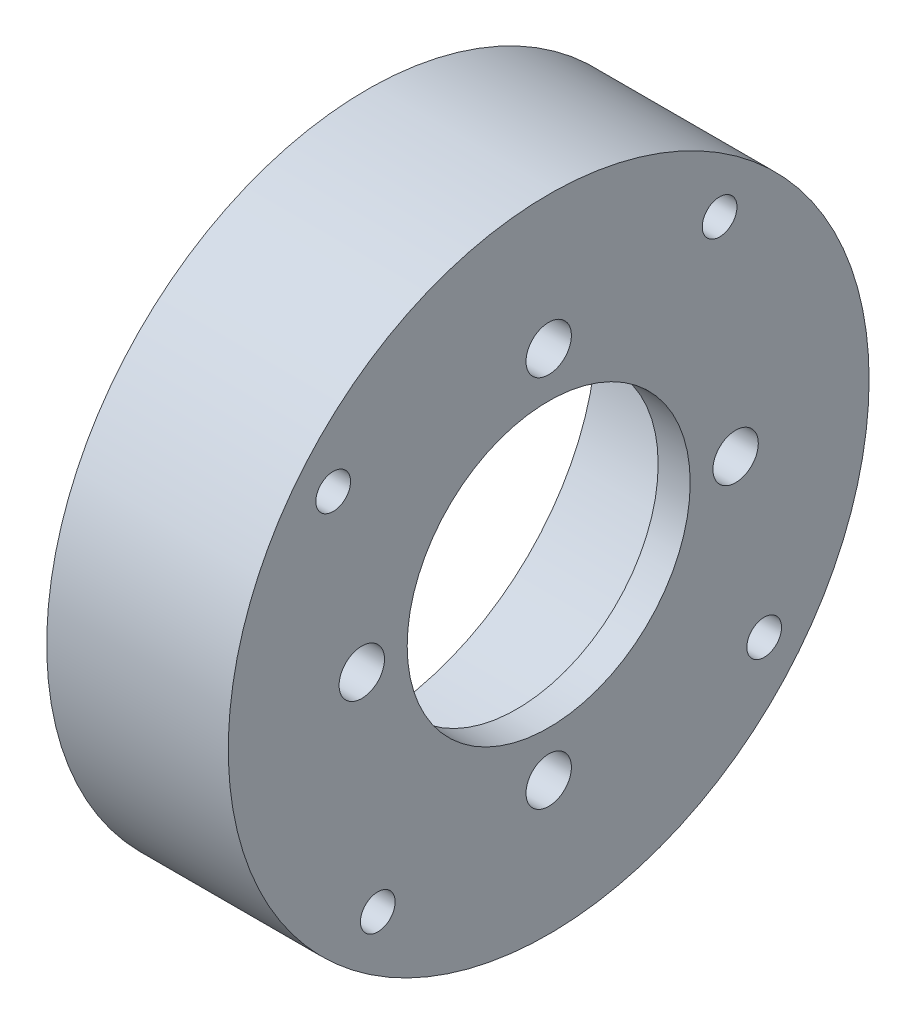
from build123d import *

# Parameters (mm, degrees)
SKETCH1_R           = 30
SKETCH1_R_2         = 21.5
BOSS_EXTRUDE1_DEPTH = 14
SKETCH2_R           = 30
SKETCH2_R_2         = 2.125
SKETCH2_R_3         = 13.25
BOSS_EXTRUDE2_DEPTH = 3
SKETCH4_R           = 1.625
CUT_EXTRUDE1_DEPTH  = 46.705579528


with BuildPart() as part:
    # Sketch1 → Boss-Extrude1 (new body)
    with BuildSketch(Plane(origin=(0, 0, 0), x_dir=(0, 0, -1), z_dir=(1, 0, 0))):
        Circle(SKETCH1_R)
        Circle(SKETCH1_R_2, mode=Mode.SUBTRACT)
    extrude(amount=BOSS_EXTRUDE1_DEPTH)

    # Sketch2 → Boss-Extrude2 (add)
    with BuildSketch(Plane(origin=(14, 0, 0), x_dir=(0, 0, -1), z_dir=(1, 0, 0))):
        Circle(SKETCH2_R)
        with Locations((0, 17.5)):
            Circle(SKETCH2_R_2, mode=Mode.SUBTRACT)
        with Locations((17.5, 0)):
            Circle(SKETCH2_R_2, mode=Mode.SUBTRACT)
        with Locations((0, -17.5)):
            Circle(SKETCH2_R_2, mode=Mode.SUBTRACT)
        with Locations((-17.5, 0)):
            Circle(SKETCH2_R_2, mode=Mode.SUBTRACT)
        Circle(SKETCH2_R_3, mode=Mode.SUBTRACT)
    extrude(amount=BOSS_EXTRUDE2_DEPTH)

    # Sketch4 → Cut-Extrude1 (cut, through all)
    with BuildSketch(Plane(origin=(17, 0, 0), x_dir=(0, 0, -1), z_dir=(1, 0, 0))):
        with Locations((-20.175789947, 16)):
            Circle(SKETCH4_R)
        with Locations((16, 20.175789947)):
            Circle(SKETCH4_R)
        with Locations((20.175789947, -16)):
            Circle(SKETCH4_R)
        with Locations((-16, -20.175789947)):
            Circle(SKETCH4_R)
    extrude(amount=-CUT_EXTRUDE1_DEPTH, mode=Mode.SUBTRACT)


solid = part.part
